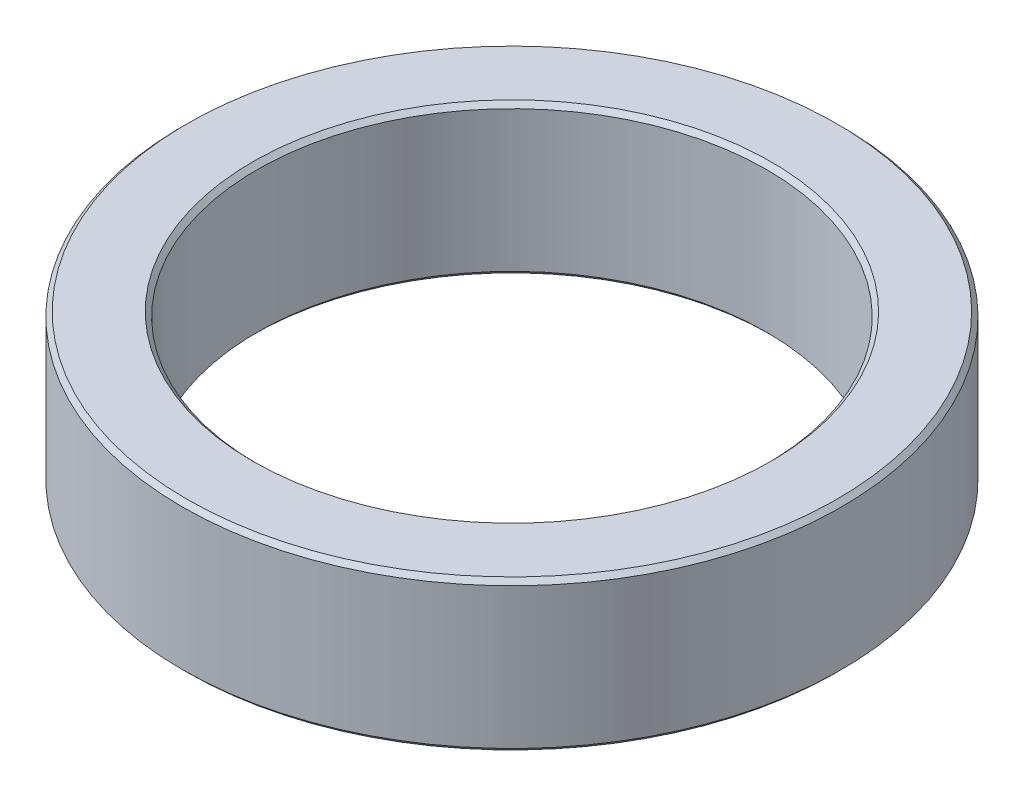
from build123d import *

# Parameters (mm, degrees)
SKETCH1_R           = 10.995
SKETCH1_R_2         = 8.5
BOSS_EXTRUDE1_DEPTH = 5
CHAMFER1_SIZE       = 0.15


with BuildPart() as part:
    # Sketch1 → Boss-Extrude1 (new body)
    with BuildSketch(Plane(origin=(0, 0, 0), x_dir=(1, 0, 0), z_dir=(0, 1, 0))):
        with Locations(Location((0, 0, 0), (0, 0, 270))):
            Circle(SKETCH1_R)
        with Locations(Location((0, 0, 0), (0, 0, 270))):
            Circle(SKETCH1_R_2, mode=Mode.SUBTRACT)
    extrude(amount=BOSS_EXTRUDE1_DEPTH)

    # Chamfer1
    chamfer1_edges = [part.edges().sort_by_distance(p)[0] for p in [
        (0, 0, -10.995),
        (0, 5, -10.995),
        (0, 0, -8.5),
        (0, 5, -8.5),
    ]]
    chamfer(chamfer1_edges, length=CHAMFER1_SIZE)


solid = part.part
